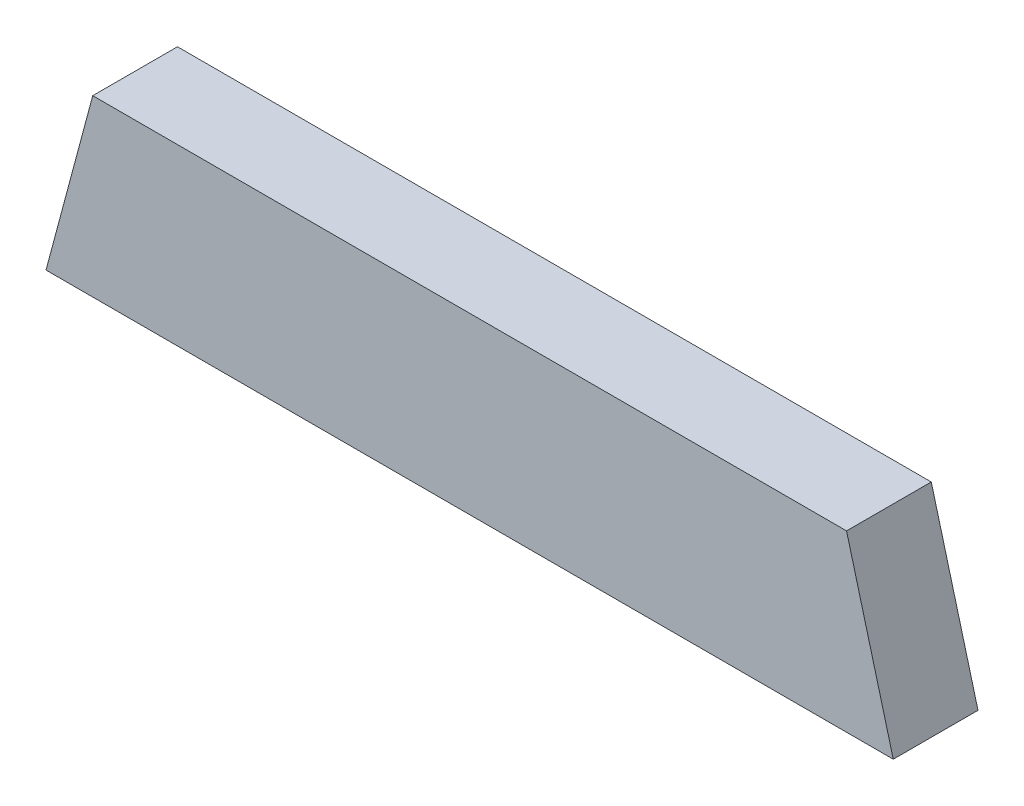
from build123d import *

# Parameters (mm, degrees)
BOSS_EXTRUDE1_DEPTH = 50.8


with BuildPart() as part:
    # Sketch1 → Boss-Extrude1 (new body)
    with BuildSketch(Plane.XY):
        Polygon((28.019995724, 104.572047671), (0, 0), (508, 0), (479.980004276, 104.572047671), align=None)
    extrude(amount=BOSS_EXTRUDE1_DEPTH)


solid = part.part
